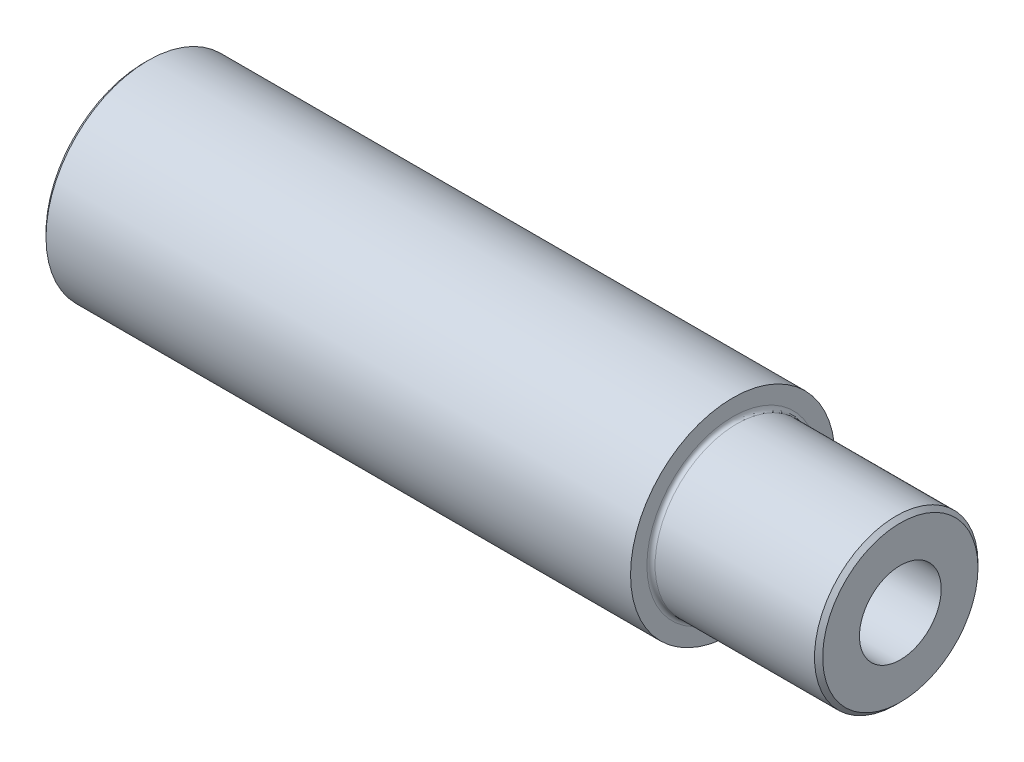
from build123d import *

# Parameters (mm, degrees)
SKETCH1_R           = 12.5
SKETCH1_R_2         = 5
BOSS_EXTRUDE1_DEPTH = 92.5
SKETCH2_OUTSIDE_W   = 46.806
SKETCH2_OUTSIDE_H   = 46.806
SKETCH2_OUTSIDE_R   = 10
CUT_EXTRUDE1_DEPTH  = 20.5
FILLET1_R           = 0.5
CHAMFER1_SIZE       = 0.5


with BuildPart() as part:
    # Sketch1 → Boss-Extrude1 (new body)
    with BuildSketch(Plane(origin=(0, 0, 0), x_dir=(0, 0, -1), z_dir=(1, 0, 0))):
        Circle(SKETCH1_R)
        Circle(SKETCH1_R_2, mode=Mode.SUBTRACT)
    extrude(amount=BOSS_EXTRUDE1_DEPTH)

    # Sketch2 outside → Cut-Extrude1 (cut)
    with BuildSketch(Plane(origin=(92.5, 0, 0), x_dir=(0, 0, -1), z_dir=(1, 0, 0))):
        Rectangle(SKETCH2_OUTSIDE_W, SKETCH2_OUTSIDE_H)
        Circle(SKETCH2_OUTSIDE_R, mode=Mode.SUBTRACT)
    extrude(amount=-CUT_EXTRUDE1_DEPTH, mode=Mode.SUBTRACT)

    # Fillet1
    fillet1_edges = [part.edges().sort_by_distance(p)[0] for p in [
        (72, 0, 10),
    ]]
    fillet(fillet1_edges, radius=FILLET1_R)

    # Chamfer1
    chamfer1_edges = [part.edges().sort_by_distance(p)[0] for p in [
        (92.5, 0, 10),
        (0, 0, 12.5),
    ]]
    chamfer(chamfer1_edges, length=CHAMFER1_SIZE)


solid = part.part
